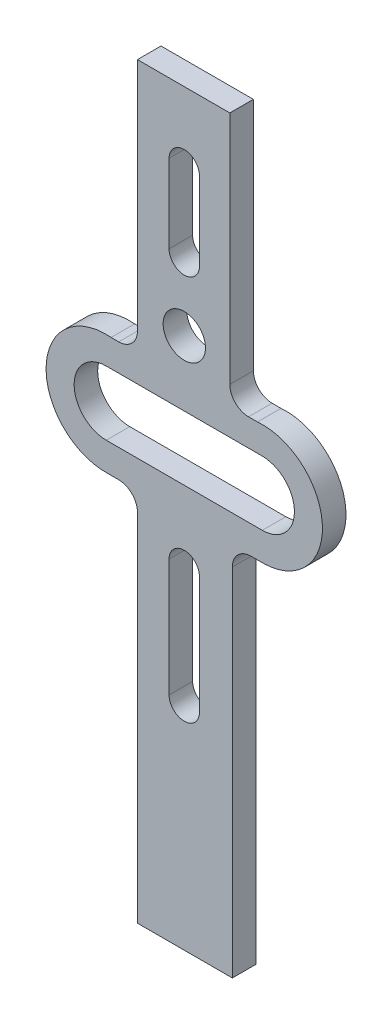
from build123d import *

# Parameters (mm, degrees)
BOSS_EXTRUDE1_DEPTH = 2.997
SKETCH2_R           = 2.6925
CUT_EXTRUDE1_DEPTH  = 99.123678721
CUT_EXTRUDE2_DEPTH  = 99.123678721
CUT_EXTRUDE3_DEPTH  = 99.123678721
CUT_EXTRUDE4_DEPTH  = 99.123678721


with BuildPart() as part:
    # Sketch1 → Boss-Extrude1 (new body)
    with BuildSketch(Plane.XY):
        with BuildLine():
            Line((0, 0), (12.08, 0))
            Line((12.08, 0), (12.08, 45.311))
            ThreePointArc((12.08, 45.311), (12.777378754, 46.994621246), (14.461, 47.692))
            Line((14.461, 47.692), (16.139481493, 47.692))
            ThreePointArc((16.139481493, 47.692), (23.535730768, 55.74130609), (15.275362275, 62.901064761))
            Line((15.275362275, 62.901064761), (14.141, 62.901064761))
            ThreePointArc((14.141, 62.901064761), (12.457378754, 63.598443515), (11.76, 65.282064761))
            Line((11.76, 65.282064761), (11.76, 95.209064761))
            Line((11.76, 95.209064761), (0, 95.209064761))
            Line((0, 95.209064761), (0, 65.282064761))
            ThreePointArc((0, 65.282064761), (-0.697378754, 63.598443515), (-2.381, 62.901064761))
            Line((-2.381, 62.901064761), (-3.358362275, 62.901064761))
            ThreePointArc((-3.358362275, 62.901064761), (-11.627796455, 55.52999861), (-3.799518507, 47.692))
            Line((-3.799518507, 47.692), (-2.381, 47.692))
            ThreePointArc((-2.381, 47.692), (-0.697378754, 46.994621246), (0, 45.311))
            Line((0, 45.311), (0, 0))
        make_face()
    extrude(amount=BOSS_EXTRUDE1_DEPTH)

    # Sketch2 → Cut-Extrude1 (cut, through all)
    with BuildSketch(Plane.XY.offset(2.997)):
        with Locations((5.959, 67.726064761)):
            Circle(SKETCH2_R)
    extrude(amount=-CUT_EXTRUDE1_DEPTH, mode=Mode.SUBTRACT)

    # Sketch3 → Cut-Extrude2 (cut, through all)
    with BuildSketch(Plane.XY.offset(2.997)):
        with BuildLine():
            Line((-3.970876758, 59.441), (15.890123242, 59.441))
            ThreePointArc((15.890123242, 59.441), (19.979623242, 55.3515), (15.890123242, 51.262))
            Line((15.890123242, 51.262), (-3.970876758, 51.262))
            ThreePointArc((-3.970876758, 51.262), (-8.060376758, 55.3515), (-3.970876758, 59.441))
        make_face()
    extrude(amount=-CUT_EXTRUDE2_DEPTH, mode=Mode.SUBTRACT)

    # Sketch4 → Cut-Extrude3 (cut, through all)
    with BuildSketch(Plane.XY.offset(2.997)):
        with BuildLine():
            Line((7.889, 86.344064761), (7.889, 76.362064761))
            ThreePointArc((7.889, 76.362064761), (5.9585, 74.431564761), (4.028, 76.362064761))
            Line((4.028, 76.362064761), (4.028, 86.344064761))
            ThreePointArc((4.028, 86.344064761), (5.9585, 88.274564761), (7.889, 86.344064761))
        make_face()
    extrude(amount=-CUT_EXTRUDE3_DEPTH, mode=Mode.SUBTRACT)

    # Sketch5 → Cut-Extrude4 (cut, through all)
    with BuildSketch(Plane.XY.offset(2.997)):
        with BuildLine():
            Line((7.889, 42.164), (7.889, 27.178))
            ThreePointArc((7.889, 27.178), (5.9585, 25.2475), (4.028, 27.178))
            Line((4.028, 27.178), (4.028, 42.164))
            ThreePointArc((4.028, 42.164), (5.9585, 44.0945), (7.889, 42.164))
        make_face()
    extrude(amount=-CUT_EXTRUDE4_DEPTH, mode=Mode.SUBTRACT)


solid = part.part
